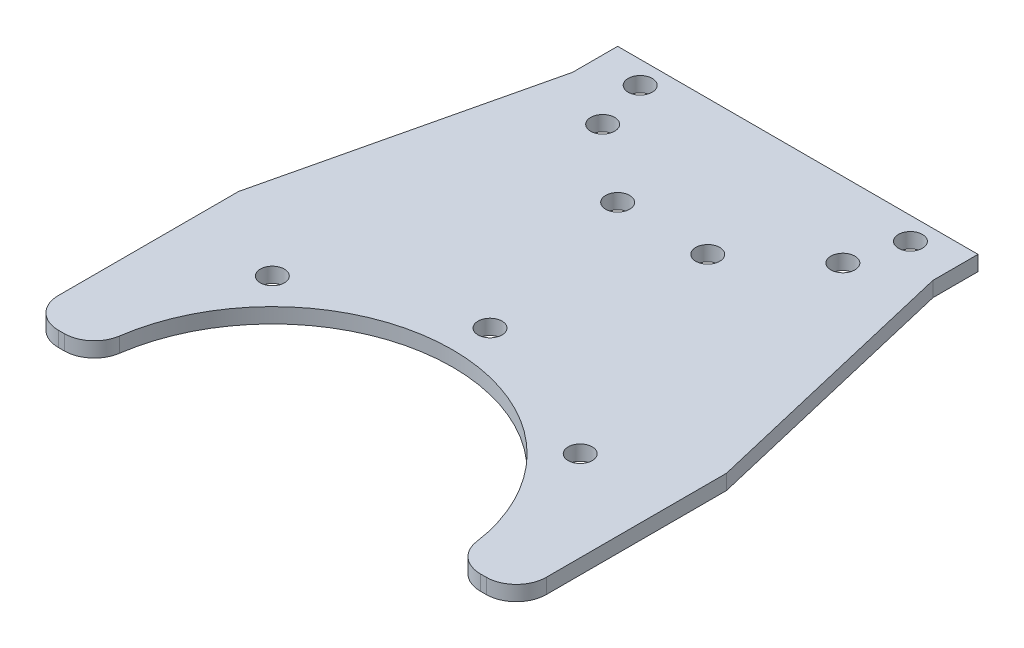
from build123d import *

# Parameters (mm, degrees)
SKETCH_1_R               = 1.6
EXTRUDE_1_DEPTH          = 1
FILLET_2_R               = 4
CUT_EXTRUDE_1_DEPTH      = 51.042481953
CUT_EXTRUDE_1_DEPTH_BACK = 51.042481953


with BuildPart() as part:
    # 草图1 → 凸台-拉伸1 (new, symmetric)
    with BuildSketch(Plane(origin=(0, 0, 0), x_dir=(1, 0, 0), z_dir=(0, 1, 0))):
        with BuildLine():
            ThreePointArc((-24, -32), (0, -8), (24, -32))
            Line((24, -32), (32.5, -32))
            Line((32.5, -32), (32.5, 32))
            Line((32.5, 32), (24, 32))
            Line((24, 32), (24, 38))
            Line((24, 38), (-24, 38))
            Line((-24, 38), (-24, 32))
            Line((-24, 32), (-32.5, 32))
            Line((-32.5, 32), (-32.5, -32))
            Line((-32.5, -32), (-24, -32))
        make_face()
        with Locations(Location((-20.506096654, -11.493903346, 0), (0, 0, 270))):
            Circle(SKETCH_1_R, mode=Mode.SUBTRACT)
        with Locations(Location((20.506096654, -11.493903346, 0), (0, 0, 270))):
            Circle(SKETCH_1_R, mode=Mode.SUBTRACT)
        with Locations(Location((-6, 20, 0), (0, 0, 270))):
            Circle(SKETCH_1_R, mode=Mode.SUBTRACT)
        with Locations(Location((-16, 28, 0), (0, 0, 270))):
            Circle(SKETCH_1_R, mode=Mode.SUBTRACT)
        with Locations(Location((0, -3, 0), (0, 0, 270))):
            Circle(SKETCH_1_R, mode=Mode.SUBTRACT)
        with Locations(Location((6, 20, 0), (0, 0, 270))):
            Circle(SKETCH_1_R, mode=Mode.SUBTRACT)
        with Locations(Location((16, 28, 0), (0, 0, 270))):
            Circle(SKETCH_1_R, mode=Mode.SUBTRACT)
        with Locations(Location((18, 35, 0), (0, 0, 270))):
            Circle(SKETCH_1_R, mode=Mode.SUBTRACT)
        with Locations(Location((-18, 35, 0), (0, 0, 270))):
            Circle(SKETCH_1_R, mode=Mode.SUBTRACT)
    extrude(amount=EXTRUDE_1_DEPTH, both=True)

    # 圆角2
    fillet_2_edges = [part.edges().sort_by_distance(p)[0] for p in [
        (32.5, 0, 32),
        (24, 0, 32),
        (-24, 0, 32),
        (-32.5, 0, 32),
    ]]
    fillet(fillet_2_edges, radius=FILLET_2_R)

    # 草图2 → 切除-拉伸1 (cut, two sides: drawn at the far end of the back side and taken through both)
    with BuildSketch(Plane(origin=(0, 1, 0), x_dir=(1, 0, 0), z_dir=(0, 1, 0)).offset(-CUT_EXTRUDE_1_DEPTH_BACK)):
        Polygon((32.5, 32), (24, 32), (32.5, -4), align=None)
        Polygon((-32.5, -4), (-32.5, 32), (-24, 32), align=None)
    extrude(amount=CUT_EXTRUDE_1_DEPTH + CUT_EXTRUDE_1_DEPTH_BACK, mode=Mode.SUBTRACT)


solid = part.part
